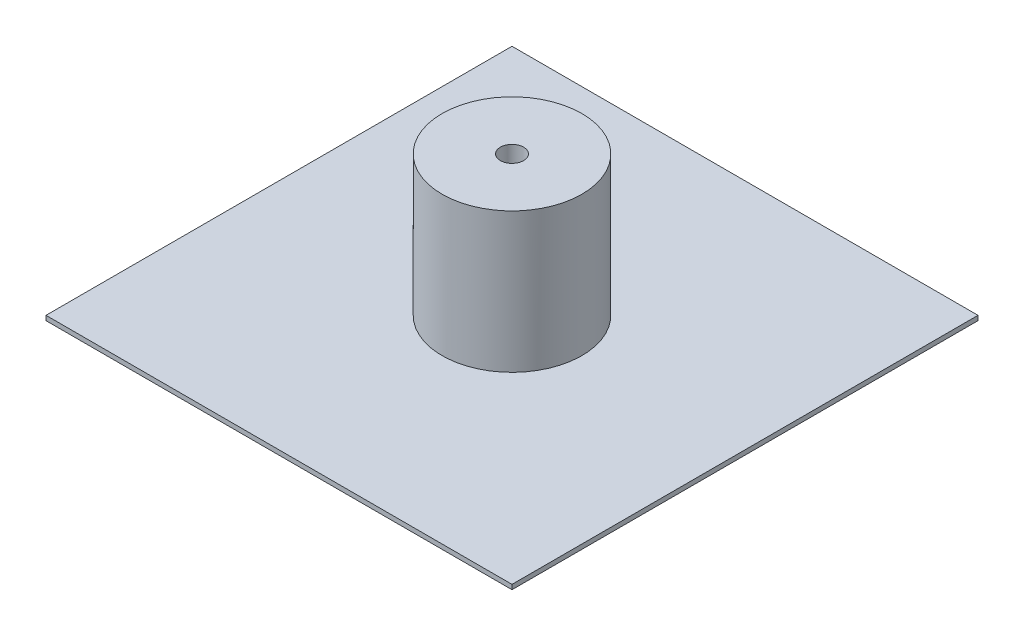
from build123d import *

# Parameters (mm, degrees)
SKETCH1_W           = 1000
SKETCH1_H           = 1000
BOSS_EXTRUDE1_DEPTH = 10
SKETCH2_R           = 150
BOSS_EXTRUDE2_DEPTH = 300
SKETCH3_R           = 25
CUT_EXTRUDE1_DEPTH  = 50


with BuildPart() as part:
    # Sketch1 → Boss-Extrude1 (new body)
    with BuildSketch(Plane(origin=(0, 0, 0), x_dir=(1, 0, 0), z_dir=(0, 1, 0))):
        Rectangle(SKETCH1_W, SKETCH1_H)
    extrude(amount=BOSS_EXTRUDE1_DEPTH)

    # Sketch2 → Boss-Extrude2 (add)
    with BuildSketch(Plane(origin=(0, 10, 0), x_dir=(1, 0, 0), z_dir=(0, 1, 0))):
        with Locations(Location((0, 0, 0), (0, 0, 90))):
            Circle(SKETCH2_R)
    extrude(amount=BOSS_EXTRUDE2_DEPTH)

    # Sketch3 → Cut-Extrude1 (cut)
    with BuildSketch(Plane(origin=(0, 310, 0), x_dir=(1, 0, 0), z_dir=(0, 1, 0))):
        with Locations(Location((0, 0, 0), (0, 0, 270))):
            Circle(SKETCH3_R)
    extrude(amount=-CUT_EXTRUDE1_DEPTH, mode=Mode.SUBTRACT)


solid = part.part
